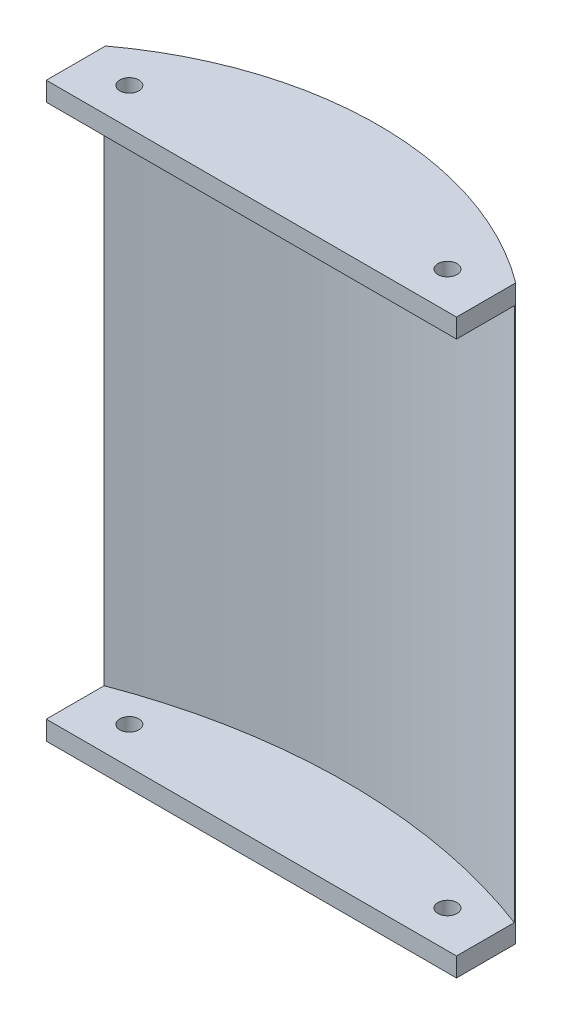
from build123d import *

# Parameters (mm, degrees)
RESSALTO_EXTRUS_O1_DEPTH = 90
ESBO_O3_W                = 91
ESBO_O3_H                = 84
ESBO_O4_R                = 1.5
CORTE_EXTRUS_O1_DEPTH    = 113.517776373


with BuildPart() as part:
    # Esboço1 → Ressalto-extrusão1 (new body)
    with BuildSketch(Plane(origin=(0, 0, 0), x_dir=(1, 0, 0), z_dir=(0, 1, 0))):
        with BuildLine():
            Line((0, 0), (64.5, 0))
            Line((64.5, 0), (64.5, 9.312094154))
            ThreePointArc((64.5, 9.312094154), (32.25, 20), (0, 9.312094154))
            Line((0, 9.312094154), (0, 0))
        make_face()
    extrude(amount=RESSALTO_EXTRUS_O1_DEPTH)

    # Esboço3 → Corte-Revolução2 (revolve, cut)
    with BuildSketch(Plane(origin=(32.25, 0, 0), x_dir=(0, 0, -1), z_dir=(1, 0, 0))):
        with Locations((-30.5, 45)):
            Rectangle(ESBO_O3_W, ESBO_O3_H)
    revolve(axis=Axis((32.25, 87, 76), (0, -1, 0)), mode=Mode.SUBTRACT)

    # Esboço4 → Corte-extrusão1 (cut, through all)
    with BuildSketch(Plane(origin=(0, 90, 0), x_dir=(1, 0, 0), z_dir=(0, 1, 0))):
        with Locations(Location((7.24, 5.82, 0), (0, 0, 270))):
            Circle(ESBO_O4_R)
        with Locations(Location((57.26, 5.82, 0), (0, 0, 270))):
            Circle(ESBO_O4_R)
    extrude(amount=-CORTE_EXTRUS_O1_DEPTH, mode=Mode.SUBTRACT)


solid = part.part
